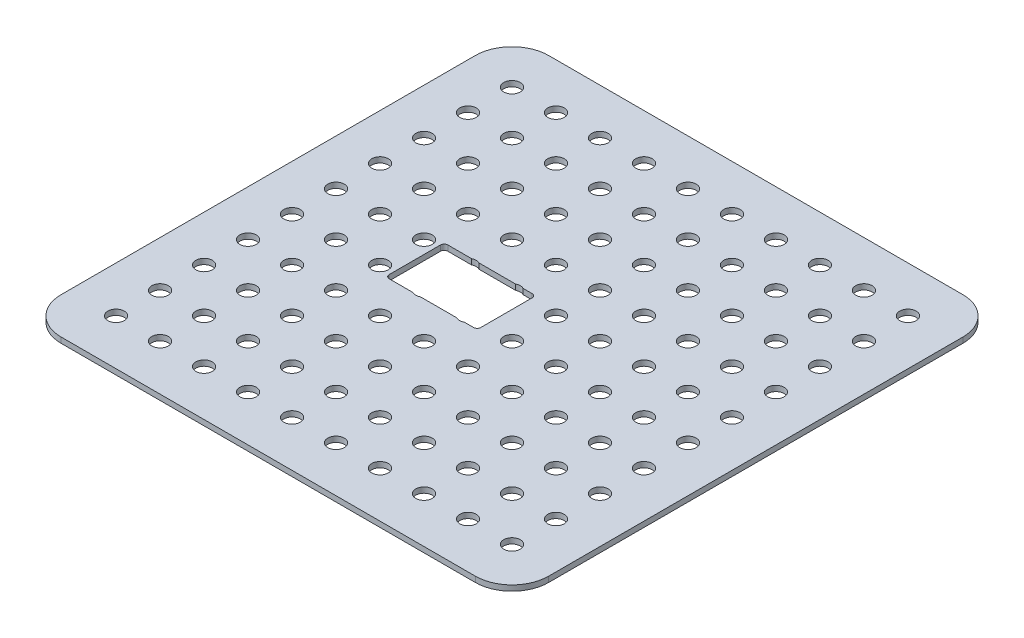
from build123d import *

# Parameters (mm, degrees)
SK_1_R                = 4.5
WAFFLE_PLATE_DEPTH    = 3
ARM_CUTOUT_DEPTH      = 238.712010635
ARM_CUTOUT_DEPTH_BACK = 238.712010635


with BuildPart() as part:
    # SK_1 → Waffle_Plate (new body)
    with BuildSketch(Plane(origin=(0, 0, 0), x_dir=(1, 0, 0), z_dir=(0, 1, 0))):
        with BuildLine():
            Line((-177, -133), (49, -133))
            ThreePointArc((49, -133), (63.142135624, -127.142135624), (69, -113))
            Line((69, -113), (69, 113))
            ThreePointArc((69, 113), (63.142135624, 127.142135624), (49, 133))
            Line((49, 133), (-177, 133))
            ThreePointArc((-177, 133), (-191.142135624, 127.142135624), (-197, 113))
            Line((-197, 113), (-197, -113))
            ThreePointArc((-197, -113), (-191.142135624, -127.142135624), (-177, -133))
        make_face()
        with Locations(Location((-172, -108, 0), (0, 0, 270))):
            Circle(SK_1_R, mode=Mode.SUBTRACT)
        with Locations(Location((-148, -108, 0), (0, 0, 270))):
            Circle(SK_1_R, mode=Mode.SUBTRACT)
        with Locations(Location((-124, -108, 0), (0, 0, 270))):
            Circle(SK_1_R, mode=Mode.SUBTRACT)
        with Locations(Location((-100, -108, 0), (0, 0, 270))):
            Circle(SK_1_R, mode=Mode.SUBTRACT)
        with Locations(Location((-76, -108, 0), (0, 0, 270))):
            Circle(SK_1_R, mode=Mode.SUBTRACT)
        with Locations(Location((-52, -108, 0), (0, 0, 270))):
            Circle(SK_1_R, mode=Mode.SUBTRACT)
        with Locations(Location((-28, -108, 0), (0, 0, 270))):
            Circle(SK_1_R, mode=Mode.SUBTRACT)
        with Locations(Location((-4, -108, 0), (0, 0, 270))):
            Circle(SK_1_R, mode=Mode.SUBTRACT)
        with Locations(Location((20, -108, 0), (0, 0, 270))):
            Circle(SK_1_R, mode=Mode.SUBTRACT)
        with Locations(Location((44, -108, 0), (0, 0, 270))):
            Circle(SK_1_R, mode=Mode.SUBTRACT)
        with Locations(Location((-148, -84, 0), (0, 0, 270))):
            Circle(SK_1_R, mode=Mode.SUBTRACT)
        with Locations(Location((-124, -84, 0), (0, 0, 270))):
            Circle(SK_1_R, mode=Mode.SUBTRACT)
        with Locations(Location((-100, -84, 0), (0, 0, 270))):
            Circle(SK_1_R, mode=Mode.SUBTRACT)
        with Locations(Location((-76, -84, 0), (0, 0, 270))):
            Circle(SK_1_R, mode=Mode.SUBTRACT)
        with Locations(Location((-52, -84, 0), (0, 0, 270))):
            Circle(SK_1_R, mode=Mode.SUBTRACT)
        with Locations(Location((-28, -84, 0), (0, 0, 270))):
            Circle(SK_1_R, mode=Mode.SUBTRACT)
        with Locations(Location((-4, -84, 0), (0, 0, 270))):
            Circle(SK_1_R, mode=Mode.SUBTRACT)
        with Locations(Location((20, -84, 0), (0, 0, 270))):
            Circle(SK_1_R, mode=Mode.SUBTRACT)
        with Locations(Location((44, -84, 0), (0, 0, 270))):
            Circle(SK_1_R, mode=Mode.SUBTRACT)
        with Locations(Location((-148, -60, 0), (0, 0, 270))):
            Circle(SK_1_R, mode=Mode.SUBTRACT)
        with Locations(Location((-124, -60, 0), (0, 0, 270))):
            Circle(SK_1_R, mode=Mode.SUBTRACT)
        with Locations(Location((-100, -60, 0), (0, 0, 270))):
            Circle(SK_1_R, mode=Mode.SUBTRACT)
        with Locations(Location((-76, -60, 0), (0, 0, 270))):
            Circle(SK_1_R, mode=Mode.SUBTRACT)
        with Locations(Location((-52, -60, 0), (0, 0, 270))):
            Circle(SK_1_R, mode=Mode.SUBTRACT)
        with Locations(Location((-28, -60, 0), (0, 0, 270))):
            Circle(SK_1_R, mode=Mode.SUBTRACT)
        with Locations(Location((-4, -60, 0), (0, 0, 270))):
            Circle(SK_1_R, mode=Mode.SUBTRACT)
        with Locations(Location((20, -60, 0), (0, 0, 270))):
            Circle(SK_1_R, mode=Mode.SUBTRACT)
        with Locations(Location((44, -60, 0), (0, 0, 270))):
            Circle(SK_1_R, mode=Mode.SUBTRACT)
        with Locations(Location((-148, -36, 0), (0, 0, 270))):
            Circle(SK_1_R, mode=Mode.SUBTRACT)
        with Locations(Location((-124, -36, 0), (0, 0, 270))):
            Circle(SK_1_R, mode=Mode.SUBTRACT)
        with Locations(Location((-100, -36, 0), (0, 0, 270))):
            Circle(SK_1_R, mode=Mode.SUBTRACT)
        with Locations(Location((-76, -36, 0), (0, 0, 270))):
            Circle(SK_1_R, mode=Mode.SUBTRACT)
        with Locations(Location((-52, -36, 0), (0, 0, 270))):
            Circle(SK_1_R, mode=Mode.SUBTRACT)
        with Locations(Location((-28, -36, 0), (0, 0, 270))):
            Circle(SK_1_R, mode=Mode.SUBTRACT)
        with Locations(Location((-4, -36, 0), (0, 0, 270))):
            Circle(SK_1_R, mode=Mode.SUBTRACT)
        with Locations(Location((20, -36, 0), (0, 0, 270))):
            Circle(SK_1_R, mode=Mode.SUBTRACT)
        with Locations(Location((44, -36, 0), (0, 0, 270))):
            Circle(SK_1_R, mode=Mode.SUBTRACT)
        with Locations(Location((-148, -12, 0), (0, 0, 270))):
            Circle(SK_1_R, mode=Mode.SUBTRACT)
        with Locations(Location((-124, -12, 0), (0, 0, 270))):
            Circle(SK_1_R, mode=Mode.SUBTRACT)
        with Locations(Location((-100, -12, 0), (0, 0, 270))):
            Circle(SK_1_R, mode=Mode.SUBTRACT)
        with Locations(Location((-76, -12, 0), (0, 0, 270))):
            Circle(SK_1_R, mode=Mode.SUBTRACT)
        with Locations(Location((-52, -12, 0), (0, 0, 270))):
            Circle(SK_1_R, mode=Mode.SUBTRACT)
        with Locations(Location((-28, -12, 0), (0, 0, 270))):
            Circle(SK_1_R, mode=Mode.SUBTRACT)
        with Locations(Location((-4, -12, 0), (0, 0, 270))):
            Circle(SK_1_R, mode=Mode.SUBTRACT)
        with Locations(Location((20, -12, 0), (0, 0, 270))):
            Circle(SK_1_R, mode=Mode.SUBTRACT)
        with Locations(Location((44, -12, 0), (0, 0, 270))):
            Circle(SK_1_R, mode=Mode.SUBTRACT)
        with Locations(Location((-148, 12, 0), (0, 0, 270))):
            Circle(SK_1_R, mode=Mode.SUBTRACT)
        with Locations(Location((-124, 12, 0), (0, 0, 270))):
            Circle(SK_1_R, mode=Mode.SUBTRACT)
        with Locations(Location((-100, 12, 0), (0, 0, 270))):
            Circle(SK_1_R, mode=Mode.SUBTRACT)
        with Locations(Location((-76, 12, 0), (0, 0, 270))):
            Circle(SK_1_R, mode=Mode.SUBTRACT)
        with Locations(Location((-52, 12, 0), (0, 0, 270))):
            Circle(SK_1_R, mode=Mode.SUBTRACT)
        with Locations(Location((-28, 12, 0), (0, 0, 270))):
            Circle(SK_1_R, mode=Mode.SUBTRACT)
        with Locations(Location((-4, 12, 0), (0, 0, 270))):
            Circle(SK_1_R, mode=Mode.SUBTRACT)
        with Locations(Location((20, 12, 0), (0, 0, 270))):
            Circle(SK_1_R, mode=Mode.SUBTRACT)
        with Locations(Location((44, 12, 0), (0, 0, 270))):
            Circle(SK_1_R, mode=Mode.SUBTRACT)
        with Locations(Location((-148, 36, 0), (0, 0, 270))):
            Circle(SK_1_R, mode=Mode.SUBTRACT)
        with Locations(Location((-124, 36, 0), (0, 0, 270))):
            Circle(SK_1_R, mode=Mode.SUBTRACT)
        with Locations(Location((-100, 36, 0), (0, 0, 270))):
            Circle(SK_1_R, mode=Mode.SUBTRACT)
        with Locations(Location((-76, 36, 0), (0, 0, 270))):
            Circle(SK_1_R, mode=Mode.SUBTRACT)
        with Locations(Location((-52, 36, 0), (0, 0, 270))):
            Circle(SK_1_R, mode=Mode.SUBTRACT)
        with Locations(Location((-28, 36, 0), (0, 0, 270))):
            Circle(SK_1_R, mode=Mode.SUBTRACT)
        with Locations(Location((-4, 36, 0), (0, 0, 270))):
            Circle(SK_1_R, mode=Mode.SUBTRACT)
        with Locations(Location((20, 36, 0), (0, 0, 270))):
            Circle(SK_1_R, mode=Mode.SUBTRACT)
        with Locations(Location((44, 36, 0), (0, 0, 270))):
            Circle(SK_1_R, mode=Mode.SUBTRACT)
        with Locations(Location((-148, 60, 0), (0, 0, 270))):
            Circle(SK_1_R, mode=Mode.SUBTRACT)
        with Locations(Location((-124, 60, 0), (0, 0, 270))):
            Circle(SK_1_R, mode=Mode.SUBTRACT)
        with Locations(Location((-100, 60, 0), (0, 0, 270))):
            Circle(SK_1_R, mode=Mode.SUBTRACT)
        with Locations(Location((-76, 60, 0), (0, 0, 270))):
            Circle(SK_1_R, mode=Mode.SUBTRACT)
        with Locations(Location((-52, 60, 0), (0, 0, 270))):
            Circle(SK_1_R, mode=Mode.SUBTRACT)
        with Locations(Location((-28, 60, 0), (0, 0, 270))):
            Circle(SK_1_R, mode=Mode.SUBTRACT)
        with Locations(Location((-4, 60, 0), (0, 0, 270))):
            Circle(SK_1_R, mode=Mode.SUBTRACT)
        with Locations(Location((20, 60, 0), (0, 0, 270))):
            Circle(SK_1_R, mode=Mode.SUBTRACT)
        with Locations(Location((44, 60, 0), (0, 0, 270))):
            Circle(SK_1_R, mode=Mode.SUBTRACT)
        with Locations(Location((-148, 84, 0), (0, 0, 270))):
            Circle(SK_1_R, mode=Mode.SUBTRACT)
        with Locations(Location((-124, 84, 0), (0, 0, 270))):
            Circle(SK_1_R, mode=Mode.SUBTRACT)
        with Locations(Location((-100, 84, 0), (0, 0, 270))):
            Circle(SK_1_R, mode=Mode.SUBTRACT)
        with Locations(Location((-76, 84, 0), (0, 0, 270))):
            Circle(SK_1_R, mode=Mode.SUBTRACT)
        with Locations(Location((-52, 84, 0), (0, 0, 270))):
            Circle(SK_1_R, mode=Mode.SUBTRACT)
        with Locations(Location((-28, 84, 0), (0, 0, 270))):
            Circle(SK_1_R, mode=Mode.SUBTRACT)
        with Locations(Location((-4, 84, 0), (0, 0, 270))):
            Circle(SK_1_R, mode=Mode.SUBTRACT)
        with Locations(Location((20, 84, 0), (0, 0, 270))):
            Circle(SK_1_R, mode=Mode.SUBTRACT)
        with Locations(Location((44, 84, 0), (0, 0, 270))):
            Circle(SK_1_R, mode=Mode.SUBTRACT)
        with Locations(Location((-148, 108, 0), (0, 0, 270))):
            Circle(SK_1_R, mode=Mode.SUBTRACT)
        with Locations(Location((-124, 108, 0), (0, 0, 270))):
            Circle(SK_1_R, mode=Mode.SUBTRACT)
        with Locations(Location((-100, 108, 0), (0, 0, 270))):
            Circle(SK_1_R, mode=Mode.SUBTRACT)
        with Locations(Location((-76, 108, 0), (0, 0, 270))):
            Circle(SK_1_R, mode=Mode.SUBTRACT)
        with Locations(Location((-52, 108, 0), (0, 0, 270))):
            Circle(SK_1_R, mode=Mode.SUBTRACT)
        with Locations(Location((-28, 108, 0), (0, 0, 270))):
            Circle(SK_1_R, mode=Mode.SUBTRACT)
        with Locations(Location((-4, 108, 0), (0, 0, 270))):
            Circle(SK_1_R, mode=Mode.SUBTRACT)
        with Locations(Location((20, 108, 0), (0, 0, 270))):
            Circle(SK_1_R, mode=Mode.SUBTRACT)
        with Locations(Location((44, 108, 0), (0, 0, 270))):
            Circle(SK_1_R, mode=Mode.SUBTRACT)
        with Locations(Location((-172, -84, 0), (0, 0, 270))):
            Circle(SK_1_R, mode=Mode.SUBTRACT)
        with Locations(Location((-172, -60, 0), (0, 0, 270))):
            Circle(SK_1_R, mode=Mode.SUBTRACT)
        with Locations(Location((-172, -36, 0), (0, 0, 270))):
            Circle(SK_1_R, mode=Mode.SUBTRACT)
        with Locations(Location((-172, -12, 0), (0, 0, 270))):
            Circle(SK_1_R, mode=Mode.SUBTRACT)
        with Locations(Location((-172, 12, 0), (0, 0, 270))):
            Circle(SK_1_R, mode=Mode.SUBTRACT)
        with Locations(Location((-172, 36, 0), (0, 0, 270))):
            Circle(SK_1_R, mode=Mode.SUBTRACT)
        with Locations(Location((-172, 60, 0), (0, 0, 270))):
            Circle(SK_1_R, mode=Mode.SUBTRACT)
        with Locations(Location((-172, 84, 0), (0, 0, 270))):
            Circle(SK_1_R, mode=Mode.SUBTRACT)
        with Locations(Location((-172, 108, 0), (0, 0, 270))):
            Circle(SK_1_R, mode=Mode.SUBTRACT)
    extrude(amount=WAFFLE_PLATE_DEPTH)

    # SK_2 → Arm_Cutout (cut, two sides: drawn at the far end of the back side and taken through both)
    with BuildSketch(Plane(origin=(0, 0, 0), x_dir=(1, 0, 0), z_dir=(0, 1, 0)).offset(-ARM_CUTOUT_DEPTH_BACK)):
        with BuildLine():
            Line((-115, -16), (-69, -16))
            ThreePointArc((-69, -16), (-67.585786438, -15.414213562), (-67, -14))
            Line((-67, -14), (-67, 14))
            ThreePointArc((-67, 14), (-67.585786438, 15.414213562), (-69, 16))
            Line((-69, 16), (-115, 16))
            ThreePointArc((-115, 16), (-116.414213562, 15.414213562), (-117, 14))
            Line((-117, 14), (-117, -14))
            ThreePointArc((-117, -14), (-116.414213562, -15.414213562), (-115, -16))
        make_face()
    extrude(amount=ARM_CUTOUT_DEPTH + ARM_CUTOUT_DEPTH_BACK, mode=Mode.SUBTRACT)


solid = part.part
